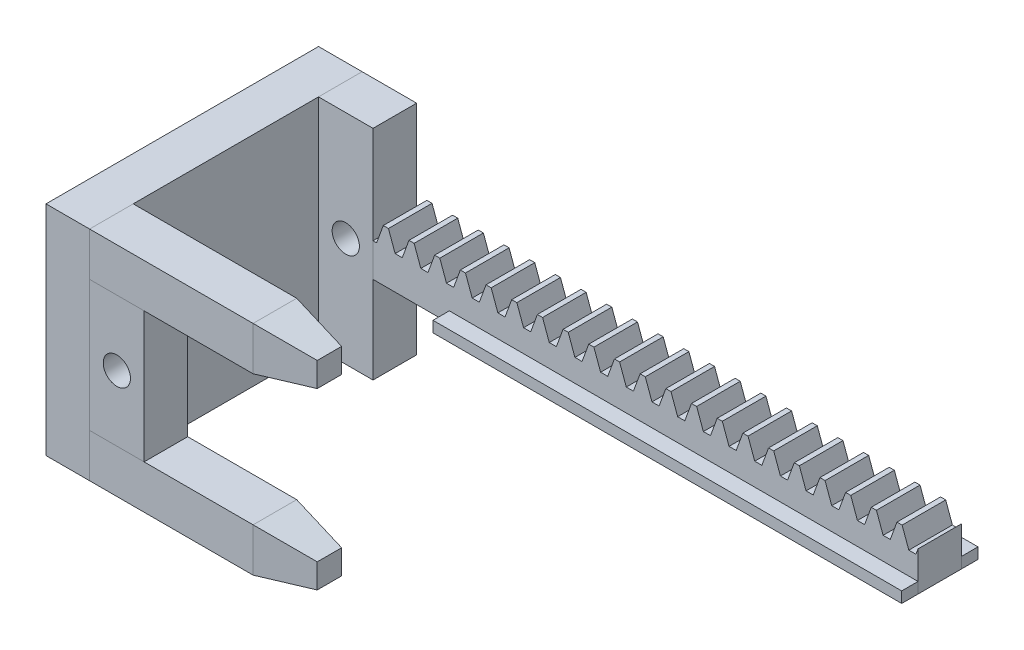
from build123d import *

# Parameters (mm, degrees)
BLANKSKE_W          = 100
BLANKSKE_H          = 9.5
BLANK_DEPTH         = 8
TOOTHCUTSIM_DEPTH   = 101.768298586
TEETHCUTS_COUNT     = 22
TEETHCUTS_PITCH     = 4.712388975
SKETCH1_W           = 3
SKETCH1_H           = 2
BOSS_EXTRUDE1_DEPTH = 100
SKETCH4_W           = 50
SKETCH4_H           = 40
BOSS_EXTRUDE2_DEPTH = 8
SKETCH5_W           = 8
SKETCH5_H           = 8
BOSS_EXTRUDE3_DEPTH = 30
SKETCH6_W           = 8
SKETCH6_H           = 8
BOSS_EXTRUDE4_DEPTH = 10
BOSS_EXTRUDE4_TAPER = 10
SKETCH8_W           = 10
SKETCH8_H           = 40
BOSS_EXTRUDE5_DEPTH = 8
SKETCH9_W           = 14
SKETCH9_H           = 3
CUT_EXTRUDE1_DEPTH  = 2
SKETCH10_W          = 3
SKETCH10_H          = 2
BOSS_EXTRUDE6_DEPTH = 90
SKETCH11_W          = 4
SKETCH11_H          = 3
CUT_EXTRUDE2_DEPTH  = 90
SKETCH12_W          = 8
SKETCH12_H          = 8
BOSS_EXTRUDE7_DEPTH = 30
SKETCH13_W          = 8
SKETCH13_H          = 8
BOSS_EXTRUDE8_DEPTH = 10
BOSS_EXTRUDE8_TAPER = 10
SKETCH14_W          = 10
SKETCH14_H          = 24
BOSS_EXTRUDE9_DEPTH = 8
SKETCH16_R          = 2.5
CUT_EXTRUDE4_DEPTH  = 116.693560775


with BuildPart() as part:
    # BlankSke → Blank (new body)
    with BuildSketch(Plane.XY):
        with Locations((50, 4.75)):
            Rectangle(BLANKSKE_W, BLANKSKE_H)
    extrude(amount=-BLANK_DEPTH)

    # TooCutSkeSim → ToothCutSim (cut, through all)
    with BuildSketch(Plane.XY):
        Polygon((0.654653055, 6.125), (-0.654653055, 6.125), (-1.892297439, 9.5254), (1.892297439, 9.5254), align=None)
    toothcutsim = extrude(amount=-TOOTHCUTSIM_DEPTH, mode=Mode.SUBTRACT)

    # TeethCuts: ToothCutSim ×22
    with Locations(*[(i * TEETHCUTS_PITCH, 0, 0) for i in range(1, TEETHCUTS_COUNT)]):
        add(toothcutsim, mode=Mode.SUBTRACT)


with BuildPart() as body_2:
    # Sketch1 → Boss-Extrude1 (new body)
    with BuildSketch(Plane.ZY):
        with Locations((1.5, 1)):
            Rectangle(SKETCH1_W, SKETCH1_H)
    extrude(amount=-BOSS_EXTRUDE1_DEPTH)

    # Sketch9 → Cut-Extrude1 (cut)
    with BuildSketch(Plane(origin=(0, 2, 0), x_dir=(1, 0, 0), z_dir=(0, 1, 0))):
        with Locations((7, -1.5)):
            Rectangle(SKETCH9_W, SKETCH9_H)
    extrude(amount=-CUT_EXTRUDE1_DEPTH, mode=Mode.SUBTRACT)


with BuildPart() as body_3:
    # Sketch4 → Boss-Extrude2 (new body)
    with BuildSketch(Plane.ZY):
        with Locations((17, 4)):
            Rectangle(SKETCH4_W, SKETCH4_H)
    extrude(amount=BOSS_EXTRUDE2_DEPTH)


with BuildPart() as body_4:
    # Sketch5 → Boss-Extrude3 (new body)
    with BuildSketch(Plane(origin=(0, 0, 0), x_dir=(0, 0, -1), z_dir=(1, 0, 0))):
        with Locations((-38, 20)):
            Rectangle(SKETCH5_W, SKETCH5_H)
    extrude(amount=BOSS_EXTRUDE3_DEPTH)


with BuildPart() as body_5:
    # Sketch6 → Boss-Extrude4 (new body)
    with BuildSketch(Plane(origin=(30, 0, 0), x_dir=(0, 0, -1), z_dir=(1, 0, 0))):
        with Locations((-38, 20)):
            Rectangle(SKETCH6_W, SKETCH6_H)
    extrude(amount=BOSS_EXTRUDE4_DEPTH, taper=BOSS_EXTRUDE4_TAPER)


with BuildPart() as body_6:
    # Sketch8 → Boss-Extrude5 (new body)
    with BuildSketch(Plane(origin=(0, 0, -8), x_dir=(-1, 0, 0), z_dir=(0, 0, -1))):
        with Locations((-5, 4)):
            Rectangle(SKETCH8_W, SKETCH8_H)
    extrude(amount=-BOSS_EXTRUDE5_DEPTH)


with BuildPart() as body_7:
    # Sketch10 → Boss-Extrude6 (new body)
    with BuildSketch(Plane(origin=(10, 0, 0), x_dir=(0, 0, -1), z_dir=(1, 0, 0))):
        with Locations((9.5, 1)):
            Rectangle(SKETCH10_W, SKETCH10_H)
    extrude(amount=BOSS_EXTRUDE6_DEPTH)

    # Sketch11 → Cut-Extrude2 (cut)
    with BuildSketch(Plane(origin=(0, 2, 0), x_dir=(1, 0, 0), z_dir=(0, 1, 0))):
        with Locations((12, 9.5)):
            Rectangle(SKETCH11_W, SKETCH11_H)
    extrude(amount=-CUT_EXTRUDE2_DEPTH, mode=Mode.SUBTRACT)


with BuildPart() as body_8:
    # Sketch12 → Boss-Extrude7 (new body)
    with BuildSketch(Plane(origin=(0, 0, 0), x_dir=(0, 0, -1), z_dir=(1, 0, 0))):
        with Locations((-38, -12)):
            Rectangle(SKETCH12_W, SKETCH12_H)
    extrude(amount=BOSS_EXTRUDE7_DEPTH)


with BuildPart() as body_9:
    # Sketch13 → Boss-Extrude8 (new body)
    with BuildSketch(Plane(origin=(30, 0, 0), x_dir=(0, 0, -1), z_dir=(1, 0, 0))):
        with Locations((-38, -12)):
            Rectangle(SKETCH13_W, SKETCH13_H)
    extrude(amount=BOSS_EXTRUDE8_DEPTH, taper=BOSS_EXTRUDE8_TAPER)


with BuildPart() as body_10:
    # Sketch14 → Boss-Extrude9 (new body)
    with BuildSketch(Plane.XY.offset(42)):
        with Locations((5, 4)):
            Rectangle(SKETCH14_W, SKETCH14_H)
    extrude(amount=-BOSS_EXTRUDE9_DEPTH)


with BuildPart() as body_4_1:
    # Body-Move/Copy1: moved
    add(body_4.part.moved(Location((-10, 0, 0))))


with BuildPart() as body_3_1:
    # Body-Move/Copy1: moved
    add(body_3.part.moved(Location((-10, 0, 0))))


with BuildPart() as body_5_1:
    # Body-Move/Copy1: moved
    add(body_5.part.moved(Location((-10, 0, 0))))


with BuildPart() as body_8_1:
    # Body-Move/Copy1: moved
    add(body_8.part.moved(Location((-10, 0, 0))))


with BuildPart() as body_9_1:
    # Body-Move/Copy1: moved
    add(body_9.part.moved(Location((-10, 0, 0))))


with BuildPart() as body_6_1:
    # Body-Move/Copy1: moved
    add(body_6.part.moved(Location((-10, 0, 0))))


with BuildPart() as body_10_1:
    # Body-Move/Copy1: moved
    add(body_10.part.moved(Location((-10, 0, 0))))


with BuildPart() as cut_extrude4_tool:
    # Sketch16 → Cut-Extrude4 (new, through all)
    with BuildSketch(Plane.XY.offset(42)):
        with Locations((-5, 4)):
            Circle(SKETCH16_R)
    extrude(amount=-CUT_EXTRUDE4_DEPTH)


with BuildPart() as body_6_2:
    add(body_6_1.part)

    # Cut-Extrude4: cut by cut_extrude4_tool
    add(cut_extrude4_tool.part, mode=Mode.SUBTRACT)


with BuildPart() as body_10_2:
    add(body_10_1.part)

    # Cut-Extrude4: cut by cut_extrude4_tool
    add(cut_extrude4_tool.part, mode=Mode.SUBTRACT)


solid = Compound([part.part, body_2.part, body_7.part, body_4_1.part, body_3_1.part, body_5_1.part, body_8_1.part, body_9_1.part, body_6_2.part, body_10_2.part])
